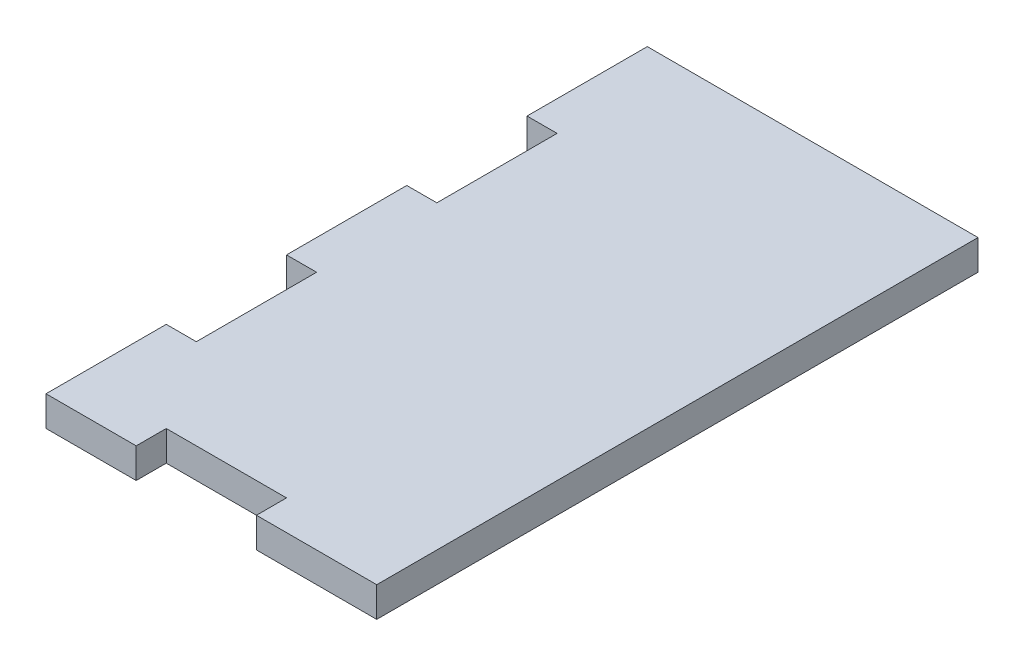
from build123d import *

# Parameters (mm, degrees)
SKETCH2_W           = 3.175
SKETCH2_H           = 12.7
BOSS_EXTRUDE2_DEPTH = 3.175


with BuildPart() as part:
    # Sketch2 → Boss-Extrude2 (new body)
    with BuildSketch(Plane(origin=(0, 0, 0), x_dir=(1, 0, 0), z_dir=(0, 1, 0))):
        Polygon((31.75, 0), (31.75, 3.175), (31.75, 63.5), (0, 63.5), (0, 50.8), (0, 38.1), (0, 25.4), (0, 12.7), (0, 0), (6.35, 0), (6.35, 3.175), (19.05, 3.175), (19.05, 0), align=None)
        with Locations((-1.5875, 57.15)):
            Rectangle(SKETCH2_W, SKETCH2_H)
        with Locations((-1.5875, 31.75)):
            Rectangle(SKETCH2_W, SKETCH2_H)
        with Locations((-1.5875, 6.35)):
            Rectangle(SKETCH2_W, SKETCH2_H)
    extrude(amount=BOSS_EXTRUDE2_DEPTH)


solid = part.part
